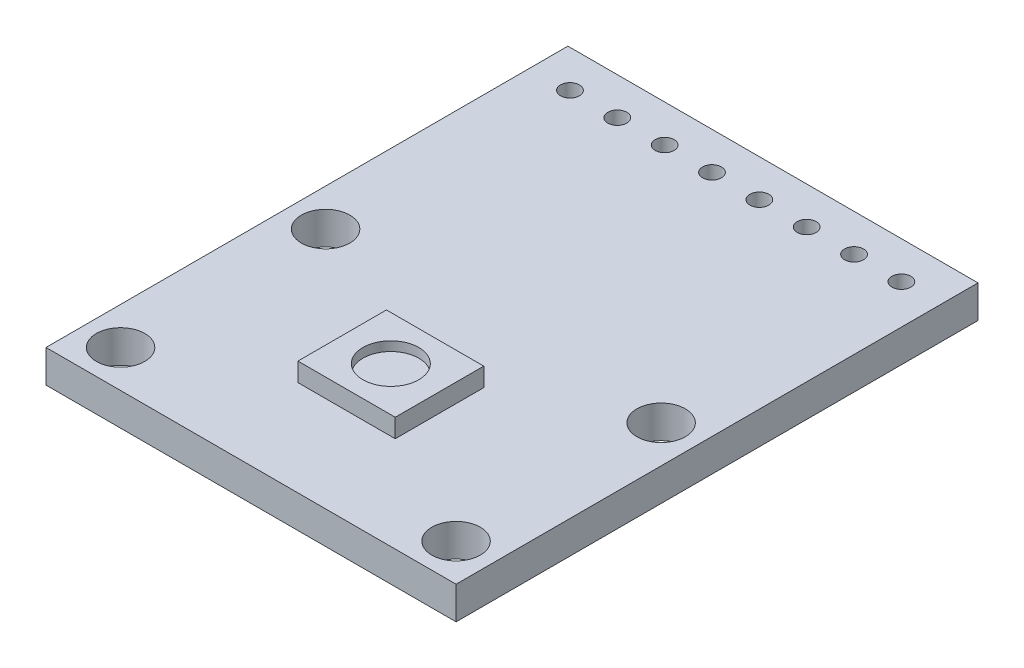
from build123d import *

# Parameters (mm, degrees)
SKETCH1_W           = 22
SKETCH1_H           = 28
SKETCH1_R           = 1.3
SKETCH1_R_2         = 0.508
BOSS_EXTRUDE1_DEPTH = 1.75
SKETCH2_W           = 5.22
SKETCH2_H           = 4.75
BOSS_EXTRUDE2_DEPTH = 1
SKETCH3_R           = 1.5
CUT_EXTRUDE1_DEPTH  = 0.5


with BuildPart() as part:
    # Sketch1 → Boss-Extrude1 (new body)
    with BuildSketch(Plane(origin=(0, 0, 0), x_dir=(1, 0, 0), z_dir=(0, 1, 0))):
        with Locations((0, 6.5)):
            Rectangle(SKETCH1_W, SKETCH1_H)
        with Locations(Location((-9, 5.5, 0), (0, 0, 270))):
            Circle(SKETCH1_R, mode=Mode.SUBTRACT)
        with Locations(Location((9, 5.5, 0), (0, 0, 270))):
            Circle(SKETCH1_R, mode=Mode.SUBTRACT)
        with Locations(Location((9, -5.5, 0), (0, 0, 270))):
            Circle(SKETCH1_R, mode=Mode.SUBTRACT)
        with Locations(Location((-9, -5.5, 0), (0, 0, 270))):
            Circle(SKETCH1_R, mode=Mode.SUBTRACT)
        with Locations(Location((-8.89, 18.5, 0), (0, 0, 270))):
            Circle(SKETCH1_R_2, mode=Mode.SUBTRACT)
        with Locations(Location((-6.35, 18.5, 0), (0, 0, 270))):
            Circle(SKETCH1_R_2, mode=Mode.SUBTRACT)
        with Locations(Location((-3.81, 18.5, 0), (0, 0, 270))):
            Circle(SKETCH1_R_2, mode=Mode.SUBTRACT)
        with Locations(Location((-1.27, 18.5, 0), (0, 0, 270))):
            Circle(SKETCH1_R_2, mode=Mode.SUBTRACT)
        with Locations(Location((1.27, 18.5, 0), (0, 0, 270))):
            Circle(SKETCH1_R_2, mode=Mode.SUBTRACT)
        with Locations(Location((3.81, 18.5, 0), (0, 0, 270))):
            Circle(SKETCH1_R_2, mode=Mode.SUBTRACT)
        with Locations(Location((6.35, 18.5, 0), (0, 0, 270))):
            Circle(SKETCH1_R_2, mode=Mode.SUBTRACT)
        with Locations(Location((8.89, 18.5, 0), (0, 0, 270))):
            Circle(SKETCH1_R_2, mode=Mode.SUBTRACT)
    extrude(amount=BOSS_EXTRUDE1_DEPTH)

    # Sketch2 → Boss-Extrude2 (add)
    with BuildSketch(Plane(origin=(0, 1.75, 0), x_dir=(1, 0, 0), z_dir=(0, 1, 0))):
        Rectangle(SKETCH2_W, SKETCH2_H)
    extrude(amount=BOSS_EXTRUDE2_DEPTH)

    # Sketch3 → Cut-Extrude1 (cut)
    with BuildSketch(Plane(origin=(0, 2.75, 0), x_dir=(1, 0, 0), z_dir=(0, 1, 0))):
        with Locations(Location((0, 0, 0), (0, 0, 270))):
            Circle(SKETCH3_R)
    extrude(amount=-CUT_EXTRUDE1_DEPTH, mode=Mode.SUBTRACT)


solid = part.part
